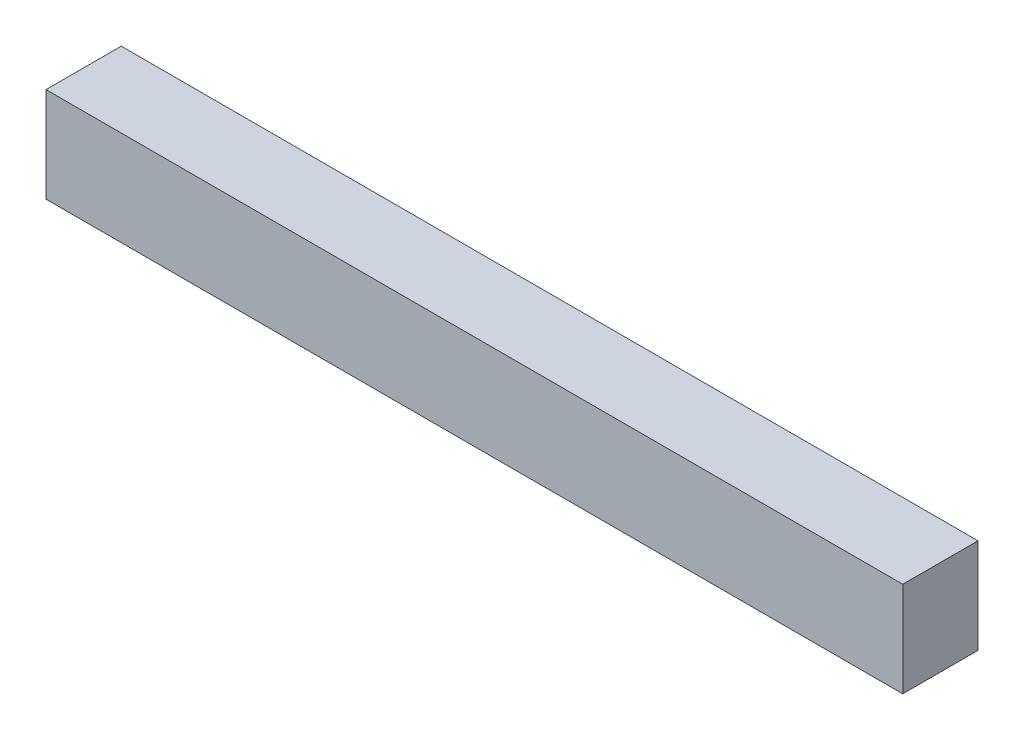
from build123d import *

# Parameters (mm, degrees)
SKETCH1_W           = 165.1
SKETCH1_H           = 18.29
BOSS_EXTRUDE2_DEPTH = 14.5


with BuildPart() as part:
    # Sketch1 → Boss-Extrude2 (new body)
    with BuildSketch(Plane.XY):
        Rectangle(SKETCH1_W, SKETCH1_H)
    extrude(amount=BOSS_EXTRUDE2_DEPTH)


solid = part.part
